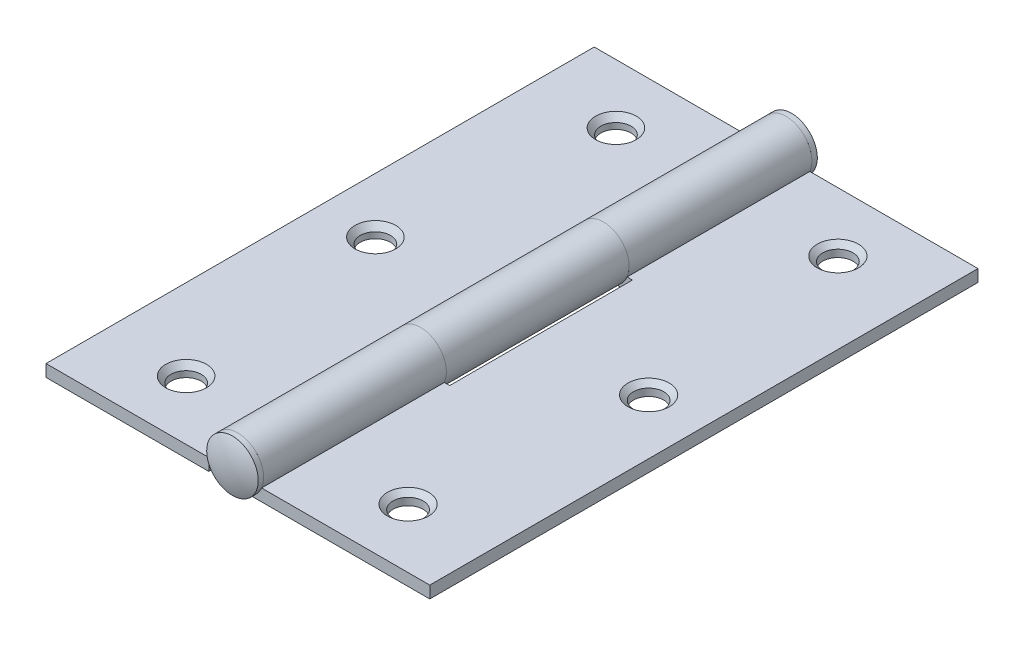
from build123d import *
from OCP.BRepFilletAPI import BRepFilletAPI_MakeChamfer

# Parameters (mm, degrees)
BOSS_EXTRUDE1_DEPTH             = 31.75
BOSS_EXTRUDE1_DEPTH_BACK        = 31.75
SKETCH4_W                       = 18.8595
SKETCH4_H                       = 1.397
BOSS_EXTRUDE1_2_DEPTH           = 31.75
BOSS_EXTRUDE1_2_DEPTH_BACK      = 31.75
SKETCH4_R                       = 1.524
SKETCH6_R                       = 1.7526
CUT_EXTRUDE1_DEPTH              = 2.54
CHAMFER1_SIZE                   = 0.6985
CHAMFER1_SIZE2                  = 0.607196786
CHAMFER2_SIZE                   = 0.635
CHAMFER2_SIZE2                  = 0.551997079
CUT_EXTRUDE2_DEPTH              = 41.008555829
CUT_EXTRUDE2_DEPTH_BACK         = 41.008555829
SKETCH8_W                       = 6.731
SKETCH8_H                       = 21.166666666
BOSS_EXTRUDE2_REACH             = 41.904
SKETCH9_R                       = 1.524
BOSS_EXTRUDE2_DIRECTION_2_REACH = 41.904


with BuildPart() as part:
    # Sketch4 → Boss-Extrude1 (new, two sides: drawn at the far end of the back side and taken through both)
    with BuildSketch(Plane.XY.offset(-BOSS_EXTRUDE1_DEPTH_BACK)):
        with Locations((-12.79525, -1.867560064)):
            Rectangle(SKETCH4_W, SKETCH4_H)
    extrude(amount=BOSS_EXTRUDE1_DEPTH + BOSS_EXTRUDE1_DEPTH_BACK)


with BuildPart() as body_2:
    # Sketch4 → Boss-Extrude1 2 (new, two sides: drawn at the far end of the back side and taken through both)
    with BuildSketch(Plane.XY.offset(-BOSS_EXTRUDE1_2_DEPTH_BACK)):
        with BuildLine():
            Line((22.225, -2.566060064), (22.225, -1.169060064))
            Line((22.225, -1.169060064), (2.746004155, -1.169060064))
            ThreePointArc((2.746004155, -1.169060064), (-2.246360639, 1.964969244), (1.524, -2.566060064))
            Line((1.524, -2.566060064), (22.225, -2.566060064))
        make_face()
        Circle(SKETCH4_R, mode=Mode.SUBTRACT)
    extrude(amount=BOSS_EXTRUDE1_2_DEPTH + BOSS_EXTRUDE1_2_DEPTH_BACK)


with BuildPart() as body_3:
    # Sketch5 → Revolve1 (revolve)
    with BuildSketch(Plane(origin=(0, 0, 0), x_dir=(1, 0, 0), z_dir=(0, 1, 0))):
        with BuildLine():
            Line((-2.9845, -31.75), (-2.9845, -32.37865))
            ThreePointArc((-2.9845, -32.37865), (-1.52499517, -32.848431867), (0, -33.0073))
            Line((0, -33.0073), (0, 33.0073))
            ThreePointArc((0, 33.0073), (-1.52499517, 32.848431867), (-2.9845, 32.37865))
            Line((-2.9845, 32.37865), (-2.9845, 31.75))
            Line((-2.9845, 31.75), (-1.524, 31.75))
            Line((-1.524, 31.75), (-1.524, -31.75))
            Line((-1.524, -31.75), (-2.9845, -31.75))
        make_face()
    revolve(axis=Axis((0, 0, -33.0073), (0, 0, 1)))


with BuildPart() as cut_extrude1_tool:
    # Sketch6 → Cut-Extrude1 (new body)
    with BuildSketch(Plane(origin=(0, -1.169060064, 0), x_dir=(1, 0, 0), z_dir=(0, 1, 0))):
        with Locations(Location((-12.8524, 24.892, 0), (0, 0, 180))):
            Circle(SKETCH6_R)
        with Locations(Location((-12.8524, -24.892, 0), (0, 0, 180))):
            Circle(SKETCH6_R)
        with Locations(Location((12.8524, -24.892, 0), (0, 0, 180))):
            Circle(SKETCH6_R)
        with Locations(Location((12.8524, 24.892, 0), (0, 0, 180))):
            Circle(SKETCH6_R)
        with Locations(Location((15.8242, 0, 0), (0, 0, 180))):
            Circle(SKETCH6_R)
        with Locations(Location((-15.8242, 0, 0), (0, 0, 180))):
            Circle(SKETCH6_R)
    extrude(amount=-CUT_EXTRUDE1_DEPTH)


with BuildPart() as part_1:
    add(part.part)

    # Cut-Extrude1: cut by cut_extrude1_tool
    add(cut_extrude1_tool.part, mode=Mode.SUBTRACT)

    # Chamfer1: one chamfer whose edges measure the first distance from different faces: ONE call of the kernel's chamfer builder (chamfer() names one face for all edges)
    chamfer1_edges_1 = [part_1.edges().sort_by_distance(p)[0] for p in [
        (-11.0998, -1.169060064, -24.892),
    ]]
    chamfer1_side_1 = [part_1.faces().sort_by_distance(p)[0] for p in [
        (-11.0998, -1.867560064, -24.892),
    ]]
    chamfer1_edges_2 = [part_1.edges().sort_by_distance(p)[0] for p in [
        (-11.0998, -1.169060064, 24.892),
    ]]
    chamfer1_side_2 = [part_1.faces().sort_by_distance(p)[0] for p in [
        (-11.0998, -1.867560064, 24.892),
    ]]
    chamfer1_edges_3 = [part_1.edges().sort_by_distance(p)[0] for p in [
        (-14.0716, -1.169060064, 0),
    ]]
    chamfer1_side_3 = [part_1.faces().sort_by_distance(p)[0] for p in [
        (-14.0716, -1.867560064, 0),
    ]]
    chamfer1 = BRepFilletAPI_MakeChamfer(part_1.part.solid().wrapped)
    for e in chamfer1_edges_1:
        chamfer1.Add(CHAMFER1_SIZE, CHAMFER1_SIZE2, e.wrapped, chamfer1_side_1[0].wrapped)  # the first distance lies on this face
    for e in chamfer1_edges_2:
        chamfer1.Add(CHAMFER1_SIZE, CHAMFER1_SIZE2, e.wrapped, chamfer1_side_2[0].wrapped)  # the first distance lies on this face
    for e in chamfer1_edges_3:
        chamfer1.Add(CHAMFER1_SIZE, CHAMFER1_SIZE2, e.wrapped, chamfer1_side_3[0].wrapped)  # the first distance lies on this face
    add(Compound.cast(chamfer1.Shape()), mode=Mode.REPLACE)


with BuildPart() as body_2_1:
    add(body_2.part)

    # Cut-Extrude1: cut by cut_extrude1_tool
    add(cut_extrude1_tool.part, mode=Mode.SUBTRACT)

    # Chamfer2
    chamfer2_edges = [body_2_1.edges().sort_by_distance(p)[0] for p in [
        (14.605, -1.169060064, 24.892),
        (14.605, -1.169060064, -24.892),
        (17.5768, -1.169060064, 0),
    ]]
    chamfer2_side = [body_2_1.faces().sort_by_distance(p)[0] for p in [
        (12.452969323, -1.169060064, 0),
    ]]
    chamfer(chamfer2_edges, length=CHAMFER2_SIZE, length2=CHAMFER2_SIZE2, reference=chamfer2_side[0])

    # Sketch8 → Cut-Extrude2 (cut, two sides: drawn at the far end of the back side and taken through both)
    with BuildSketch(Plane(origin=(0, -1.169060064, 0), x_dir=(1, 0, 0), z_dir=(0, 1, 0)).offset(-CUT_EXTRUDE2_DEPTH_BACK)):
        Rectangle(SKETCH8_W, SKETCH8_H)
    extrude(amount=CUT_EXTRUDE2_DEPTH + CUT_EXTRUDE2_DEPTH_BACK, mode=Mode.SUBTRACT)


with BuildPart() as body_4:

    # Boss-Extrude2: up to this face of the body (flat: up to its plane)
    boss_extrude2_end = Plane(body_2_1.part.faces().sort_by_distance((3.055752077, -1.256210199, -10.583333333))[0])
    # Sketch9 → Boss-Extrude2 (new, up to the picked face)
    with BuildSketch(Plane.XY, mode=Mode.PRIVATE) as boss_extrude2_sk1:
        with BuildLine():
            Line((-3.3655, -2.566060064), (-1.524, -2.566060064))
            ThreePointArc((-1.524, -2.566060064), (0, -2.9845), (1.524, -2.566060064))
            ThreePointArc((1.524, -2.566060064), (2.246360639, -1.964969244), (2.746004155, -1.169060064))
            ThreePointArc((2.746004155, -1.169060064), (0, 2.9845), (-2.746004155, -1.169060064))
            Line((-2.746004155, -1.169060064), (-3.3655, -1.169060064))
            Line((-3.3655, -1.169060064), (-3.3655, -2.566060064))
        make_face()
        with Locations(Location((0, 0, 0), (0, 0, 180))):
            Circle(SKETCH9_R, mode=Mode.SUBTRACT)
    boss_extrude2_tool1 = split(extrude(boss_extrude2_sk1.sketch, amount=-BOSS_EXTRUDE2_REACH, mode=Mode.PRIVATE), bisect_by=boss_extrude2_end, keep=Keep.BOTH, mode=Mode.PRIVATE)
    add(boss_extrude2_tool1.solids().sort_by(Axis((-3.055752, -1.25621, 0), (0, 0, -1)))[0])


    # Boss-Extrude2 direction 2: up to this face of the body (flat: up to its plane)
    boss_extrude2_direction_2_end = Plane(body_2_1.part.faces().sort_by_distance((3.278349865, -1.867560064, 10.583333333))[0])
    # Sketch9 → Boss-Extrude2 direction 2 (add, up to the picked face)
    with BuildSketch(Plane.XY, mode=Mode.PRIVATE) as boss_extrude2_direction_2_sk1:
        with BuildLine():
            Line((-3.3655, -2.566060064), (-1.524, -2.566060064))
            ThreePointArc((-1.524, -2.566060064), (0, -2.9845), (1.524, -2.566060064))
            ThreePointArc((1.524, -2.566060064), (2.246360639, -1.964969244), (2.746004155, -1.169060064))
            ThreePointArc((2.746004155, -1.169060064), (0, 2.9845), (-2.746004155, -1.169060064))
            Line((-2.746004155, -1.169060064), (-3.3655, -1.169060064))
            Line((-3.3655, -1.169060064), (-3.3655, -2.566060064))
        make_face()
        with Locations(Location((0, 0, 0), (0, 0, 180))):
            Circle(SKETCH9_R, mode=Mode.SUBTRACT)
    boss_extrude2_direction_2_tool1 = split(extrude(boss_extrude2_direction_2_sk1.sketch, amount=BOSS_EXTRUDE2_DIRECTION_2_REACH, mode=Mode.PRIVATE), bisect_by=boss_extrude2_direction_2_end, keep=Keep.BOTH, mode=Mode.PRIVATE)
    add(boss_extrude2_direction_2_tool1.solids().sort_by(Axis((-3.055752, -1.25621, 0), (0, 0, 1)))[0])

    # Combine1: union part
    add(part_1.part)


solid = Compound([body_3.part, body_2_1.part, body_4.part])
